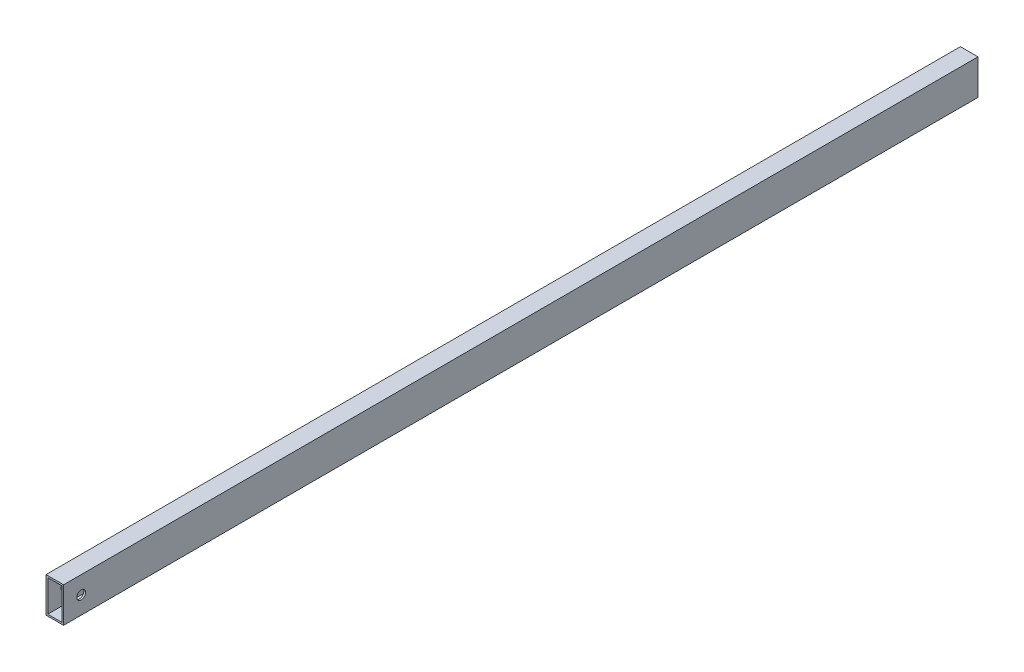
from build123d import *

# Parameters (mm, degrees)
SKETCH1_W           = 25.4
SKETCH1_H           = 50.8
SKETCH1_W_2         = 20.32
SKETCH1_H_2         = 45.72
BOSS_EXTRUDE1_DEPTH = 1320.8
SKETCH2_R           = 6.35
CUT_EXTRUDE1_DEPTH  = 1323.020589855


with BuildPart() as part:
    # Sketch1 → Boss-Extrude1 (new body)
    with BuildSketch(Plane.XY):
        with Locations((12.7, 25.4)):
            Rectangle(SKETCH1_W, SKETCH1_H)
        with Locations((12.7, 25.4)):
            Rectangle(SKETCH1_W_2, SKETCH1_H_2, mode=Mode.SUBTRACT)
    extrude(amount=BOSS_EXTRUDE1_DEPTH)

    # Sketch2 → Cut-Extrude1 (cut, through all)
    with BuildSketch(Plane(origin=(25.4, 0, 0), x_dir=(0, 0, -1), z_dir=(1, 0, 0))):
        with Locations(Location((-1295.4, 25.4, 0), (0, 0, 90))):
            Circle(SKETCH2_R)
    extrude(amount=-CUT_EXTRUDE1_DEPTH, mode=Mode.SUBTRACT)


solid = part.part
